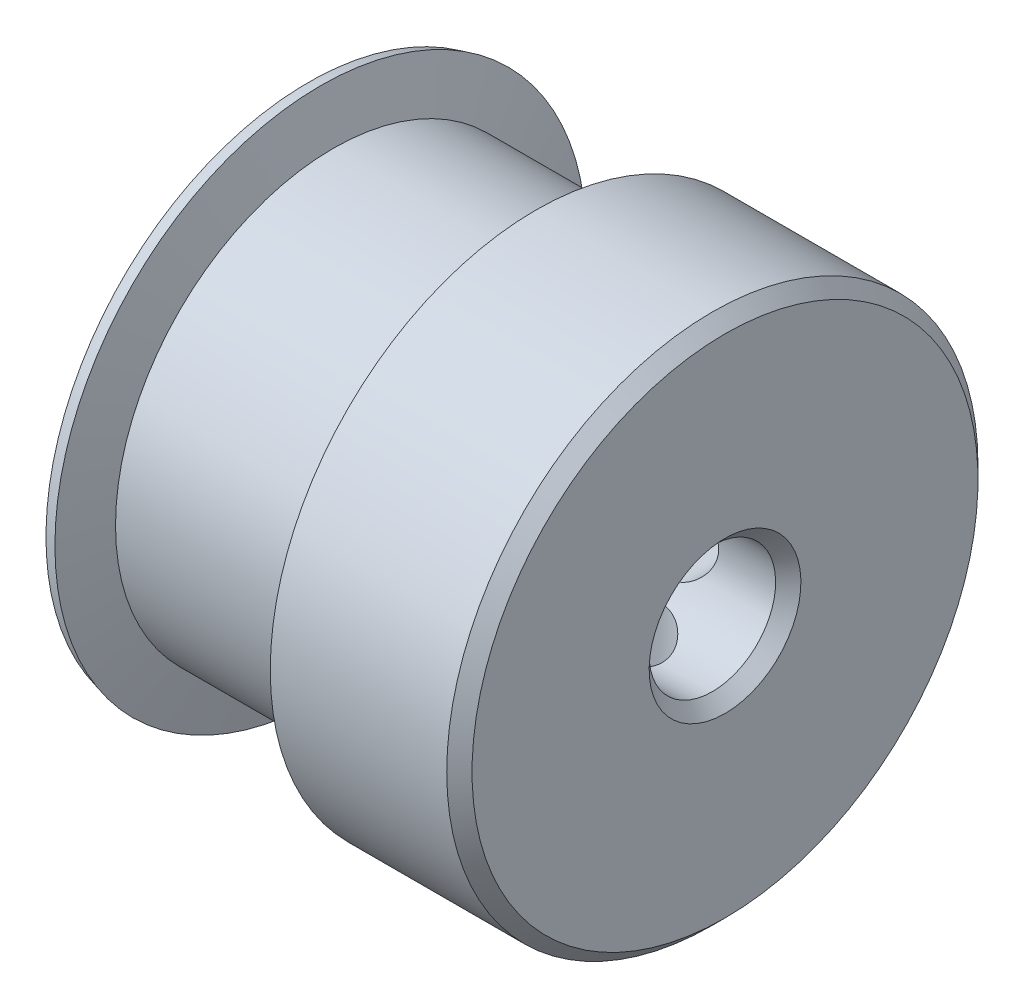
from build123d import *

# Parameters (mm, degrees)
TAGLIO_ESTRUSIONE1_REACH      = 19.096
TAGLIO_ESTRUSIONE1_END_RADIUS = 10.5
SCHIZZO2_R                    = 1.5
TAGLIO_ESTRUSIONE2_REACH      = 19.096
TAGLIO_ESTRUSIONE2_END_RADIUS = 10.5
SCHIZZO3_R                    = 1.5


with BuildPart() as part:
    # Schizzo1 → Rivoluzione1 (revolve)
    with BuildSketch(Plane.XY, mode=Mode.PRIVATE) as rivoluzione1_sk:
        Polygon((-8, 3), (-7.5, 2.5), (7.5, 2.5), (8, 3), (8, 10), (7.5, 10.5), (0.524062064, 10.5), (0.01763809, 8.61), (-7.48236191, 8.61), (-7.988785883, 10.5), (-8.471748797, 10.370590477), (-8, 8.61), align=None)
    revolve(rivoluzione1_sk.sketch.rotate(Axis((-8, 0, 0), (1, 0, 0)), 180), axis=Axis((-8, 0, 0), (1, 0, 0)))

    # Taglio-Estrusione1: up to this cylinder (the profile starts inside it)
    taglio_estrusione1_end = Plane(origin=(3.75, 0, 0), z_dir=(-1, 0, 0)) * Cylinder(TAGLIO_ESTRUSIONE1_END_RADIUS, 60.192, mode=Mode.PRIVATE)
    # Schizzo2 → Taglio-Estrusione1 (cut, up to the surface)
    with BuildSketch(Plane.XY, mode=Mode.PRIVATE) as taglio_estrusione1_sk1:
        with Locations((3.75, 0)):
            Circle(SCHIZZO2_R)
    taglio_estrusione1_tool1 = extrude(taglio_estrusione1_sk1.sketch, amount=-TAGLIO_ESTRUSIONE1_REACH, mode=Mode.PRIVATE) & taglio_estrusione1_end
    add(taglio_estrusione1_tool1.solids().sort_by_distance((3.75, 0, 0))[0], mode=Mode.SUBTRACT)

    # Taglio-Estrusione2: up to this cylinder (the profile starts inside it)
    taglio_estrusione2_end = Plane(origin=(4.012031, 0, 0), z_dir=(-1, 0, 0)) * Cylinder(TAGLIO_ESTRUSIONE2_END_RADIUS, 60.192, mode=Mode.PRIVATE)
    # Schizzo3 → Taglio-Estrusione2 (cut, up to the surface)
    with BuildSketch(Plane(origin=(0, 0, 0), x_dir=(1, 0, 0), z_dir=(0, 1, 0)), mode=Mode.PRIVATE) as taglio_estrusione2_sk1:
        with Locations(Location((4.012031032, 0, 0), (0, 0, 270))):
            Circle(SCHIZZO3_R)
    taglio_estrusione2_tool1 = extrude(taglio_estrusione2_sk1.sketch, amount=-TAGLIO_ESTRUSIONE2_REACH, mode=Mode.PRIVATE) & taglio_estrusione2_end
    add(taglio_estrusione2_tool1.solids().sort_by_distance((4.012031, 0, 0))[0], mode=Mode.SUBTRACT)


solid = part.part
